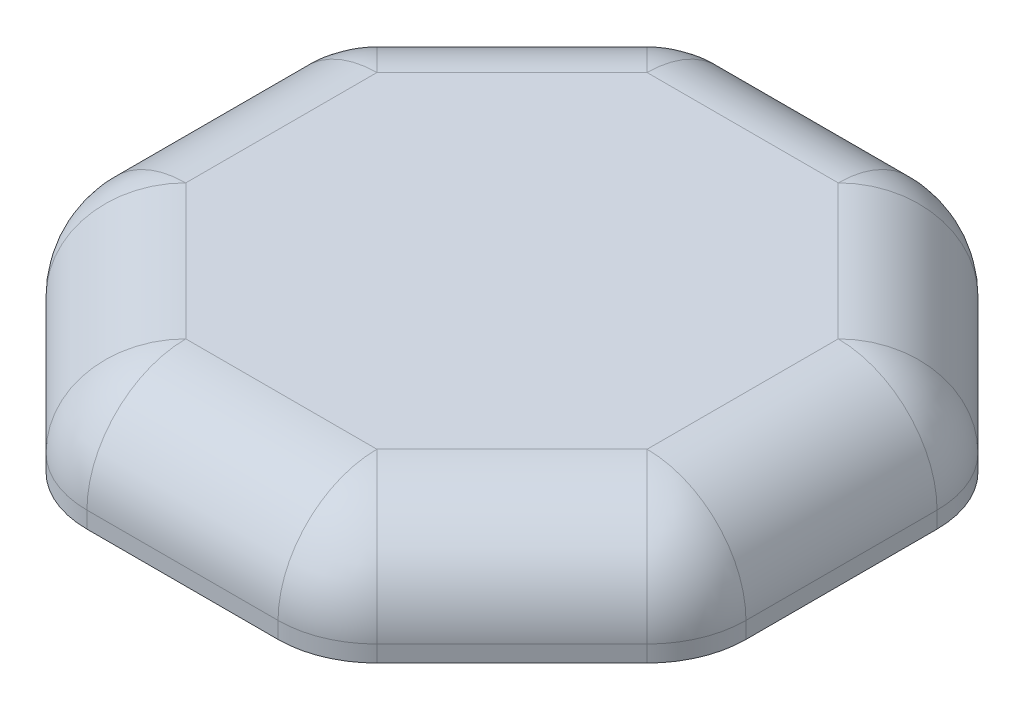
from build123d import *

# Parameters (mm, degrees)
BOSS_EXTRUDE1_DEPTH = 35
FILLET9_R           = 30
FILLET12_R          = 30
SHELL2_T            = -2


with BuildPart() as part:
    # Sketch1 → Boss-Extrude1 (new body)
    with BuildSketch(Plane(origin=(0, 0, 0), x_dir=(1, 0, 0), z_dir=(0, 1, 0))):
        Polygon((100, 41.421356237), (41.421356237, 100), (-41.421356237, 100), (-100, 41.421356237), (-100, -41.421356237), (-41.421356237, -100), (41.421356237, -100), (100, -41.421356237), align=None)
    extrude(amount=BOSS_EXTRUDE1_DEPTH)

    # Fillet9
    fillet9_edges = [part.edges().sort_by_distance(p)[0] for p in [
        (-100, 17.5, 41.421356237),
        (-100, 17.5, -41.421356237),
        (-41.421356237, 17.5, -100),
        (41.421356237, 17.5, -100),
        (100, 17.5, -41.421356237),
        (100, 17.5, 41.421356237),
        (41.421356237, 17.5, 100),
        (-41.421356237, 17.5, 100),
    ]]
    fillet(fillet9_edges, radius=FILLET9_R)

    # Fillet12
    fillet12_edges = [part.edges().sort_by_distance(p)[0] for p in [
        (-97.716385975, 35, 40.475452337),
        (-100, 35, 0),
        (-97.716385975, 35, -40.475452337),
        (-70.710678119, 35, -70.710678119),
        (-40.475452337, 35, -97.716385975),
        (0, 35, -100),
        (40.475452337, 35, -97.716385975),
        (70.710678119, 35, -70.710678119),
        (97.716385975, 35, -40.475452337),
        (100, 35, 0),
        (97.716385975, 35, 40.475452337),
        (70.710678119, 35, 70.710678119),
        (40.475452337, 35, 97.716385975),
        (0, 35, 100),
        (-40.475452337, 35, 97.716385975),
        (-70.710678119, 35, 70.710678119),
    ]]
    fillet(fillet12_edges, radius=FILLET12_R)

    # Shell2
    shell2_openings = [part.faces().sort_by_distance(p)[0] for p in [
        (0, 0, 0),
    ]]
    offset(amount=SHELL2_T, openings=shell2_openings, kind=Kind.INTERSECTION)


solid = part.part
